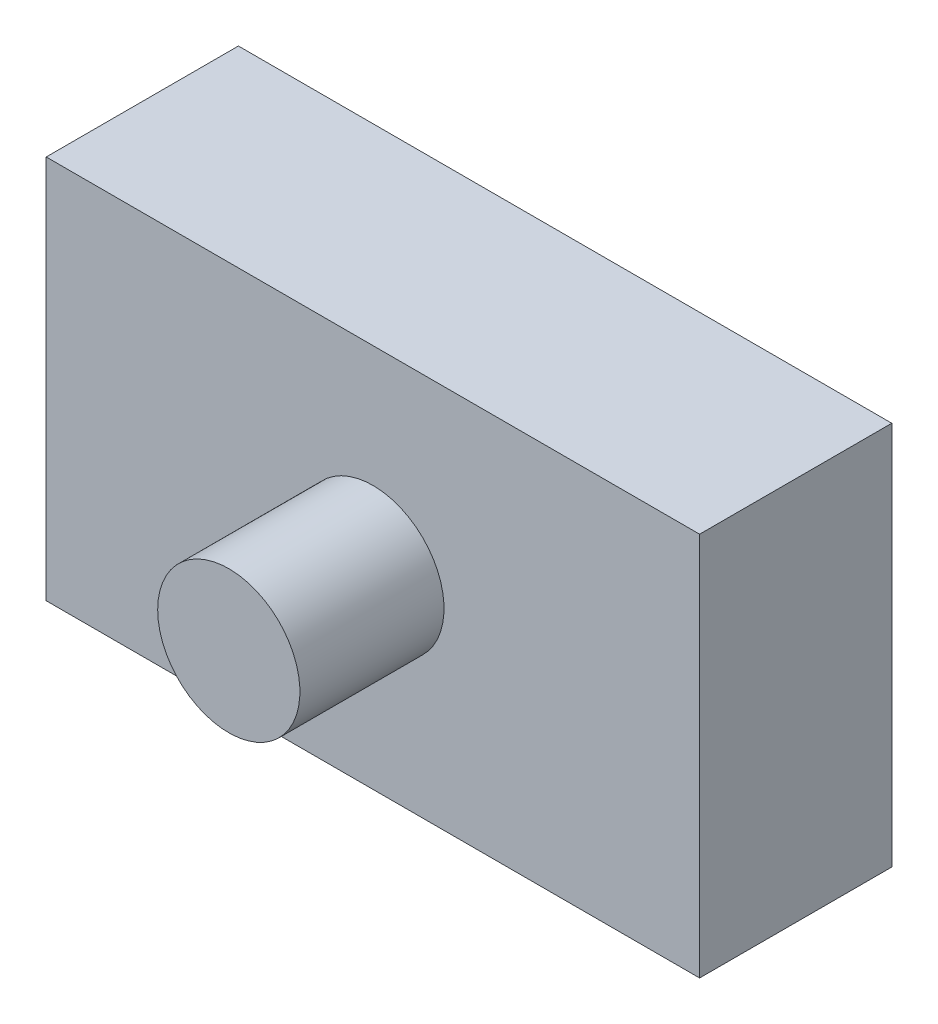
from build123d import *

# Parameters (mm, degrees)
SKETCH2_W           = 43.18
SKETCH2_H           = 25.4
BOSS_EXTRUDE3_DEPTH = 12.7
SKETCH4_R           = 4.699
BOSS_EXTRUDE4_DEPTH = 9.525


with BuildPart() as part:
    # Sketch2 → Boss-Extrude3 (new body)
    with BuildSketch(Plane.XY):
        Rectangle(SKETCH2_W, SKETCH2_H)
    extrude(amount=-BOSS_EXTRUDE3_DEPTH)

    # Sketch4 → Boss-Extrude4 (add)
    with BuildSketch(Plane.XY):
        with Locations(Location((0, 0, 0), (0, 0, 180))):
            Circle(SKETCH4_R)
    extrude(amount=BOSS_EXTRUDE4_DEPTH)


solid = part.part
